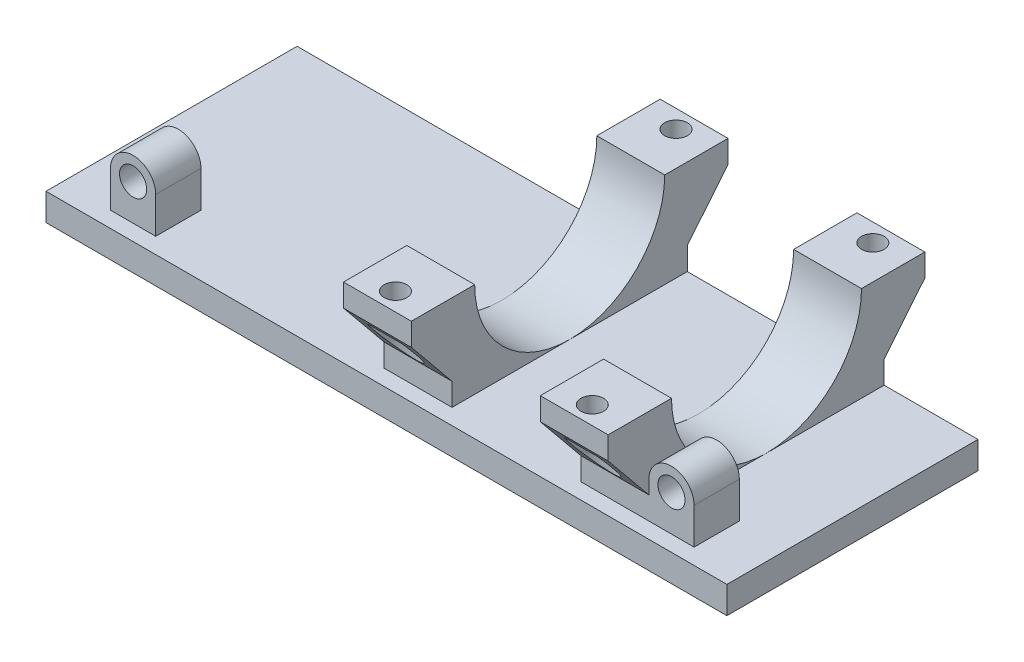
from build123d import *

# Parameters (mm, degrees)
CROQUIS1_W                                  = 149
CROQUIS1_H                                  = 53
SALIENTE_EXTRUIR1_DEPTH                     = 6
SALIENTE_EXTRUIR2_DEPTH                     = 15
SALIENTE_EXTRUIR5_DEPTH                     = 15
CROQUIS3_R                                  = 21
CORTAR_EXTRUIR2_DEPTH                       = 140.238105417
CROQUIS6_R                                  = 3
SALIENTE_EXTRUIR11_DEPTH                    = 10
CROQUIS10_W                                 = 149
CROQUIS10_H                                 = 6
SALIENTE_EXTRUIR23_DEPTH                    = 3
CROQUIS11_W                                 = 2.25
CROQUIS11_H                                 = 56
CORTAR_EXTRUIR3_DEPTH                       = 93.895102131
CROQUIS12_W                                 = 56
CROQUIS12_H                                 = 6
SALIENTE_EXTRUIR24_DEPTH                    = 3.75
CROQUIS13_W                                 = 150.5
CROQUIS13_H                                 = 0.5
CORTAR_EXTRUIR4_DEPTH                       = 96.928684448
CROQUIS14_W                                 = 169.427236994
CROQUIS14_H                                 = 76.033419256
CORTAR_EXTRUIR5_DEPTH                       = 88.876689173
SALIENTE_EXTRUIR25_DEPTH                    = 15
CROQUIS16_R                                 = 2.5
CORTAR_EXTRUIR6_DEPTH                       = 10
CROQUIS17_R                                 = 4.5
CORTAR_EXTRUIR7_DEPTH                       = 10
SIMETR_A14_AT_THE_SECOND_PLANE_COPY_1_DEPTH = 15
SIMETR_A14_AT_THE_SECOND_PLANE_COPY_2_SK_R  = 2.5
SIMETR_A14_AT_THE_SECOND_PLANE_COPY_2_DEPTH = 10
SIMETR_A14_AT_THE_SECOND_PLANE_COPY_3_SK_R  = 4.5
SIMETR_A14_AT_THE_SECOND_PLANE_COPY_3_DEPTH = 10


with BuildPart() as part:
    # Croquis1 → Saliente-Extruir1 (new body)
    with BuildSketch(Plane(origin=(0, 0, 0), x_dir=(1, 0, 0), z_dir=(0, 1, 0))):
        Rectangle(CROQUIS1_W, CROQUIS1_H)
    extrude(amount=SALIENTE_EXTRUIR1_DEPTH)

    # Croquis2 → Saliente-Extruir2 (add)
    with BuildSketch(Plane(origin=(51.5, 0, 0), x_dir=(0, 0, -1), z_dir=(1, 0, 0))):
        with BuildLine():
            Line((26, 6), (-26, 6))
            Line((-26, 6), (-26, 27))
            ThreePointArc((-26, 27), (0, 53), (26, 27))
            Line((26, 27), (26, 6))
        make_face()
    extrude(amount=-SALIENTE_EXTRUIR2_DEPTH)

    # Croquis5 → Saliente-Extruir5 (add)
    with BuildSketch(Plane.ZY.offset(-8)):
        with BuildLine():
            Line((-26, 6), (26, 6))
            Line((26, 6), (26, 27))
            ThreePointArc((26, 27), (0, 53), (-26, 27))
            Line((-26, 27), (-26, 6))
        make_face()
    extrude(amount=SALIENTE_EXTRUIR5_DEPTH)

    # Croquis3 → Cortar-Extruir2 (cut, through all)
    with BuildSketch(Plane(origin=(51.5, 0, 0), x_dir=(0, 0, -1), z_dir=(1, 0, 0))):
        with Locations(Location((0, 27, 0), (0, 0, 270))):
            Circle(CROQUIS3_R)
    extrude(amount=-CORTAR_EXTRUIR2_DEPTH, mode=Mode.SUBTRACT)

    # Croquis10 → Saliente-Extruir23 (add)
    with BuildSketch(Plane.XY.offset(26.5)):
        with Locations((0, 3)):
            Rectangle(CROQUIS10_W, CROQUIS10_H)
    extrude(amount=SALIENTE_EXTRUIR23_DEPTH)

    # Croquis11 → Cortar-Extruir3 (cut, through all)
    with BuildSketch(Plane(origin=(0, 6, 0), x_dir=(1, 0, 0), z_dir=(0, 1, 0))):
        with Locations((73.375, -1.5)):
            Rectangle(CROQUIS11_W, CROQUIS11_H)
    extrude(amount=-CORTAR_EXTRUIR3_DEPTH, mode=Mode.SUBTRACT)

    # Croquis12 → Saliente-Extruir24 (add)
    with BuildSketch(Plane.ZY.offset(74.5)):
        with Locations((1.5, 3)):
            Rectangle(CROQUIS12_W, CROQUIS12_H)
    extrude(amount=SALIENTE_EXTRUIR24_DEPTH)

    # Croquis13 → Cortar-Extruir4 (cut, through all)
    with BuildSketch(Plane(origin=(0, 6, 0), x_dir=(1, 0, 0), z_dir=(0, 1, 0))):
        with Locations((-3, 26.25)):
            Rectangle(CROQUIS13_W, CROQUIS13_H)
    extrude(amount=-CORTAR_EXTRUIR4_DEPTH, mode=Mode.SUBTRACT)

    # Croquis14 → Cortar-Extruir5 (cut, through all)
    with BuildSketch(Plane(origin=(0, 27, 0), x_dir=(-1, 0, 0), z_dir=(0, -1, 0))):
        Rectangle(CROQUIS14_W, CROQUIS14_H)
    extrude(amount=-CORTAR_EXTRUIR5_DEPTH, mode=Mode.SUBTRACT)



with BuildPart() as body_2:
    # Croquis6 → Saliente-Extruir11 (new body)
    with BuildSketch(Plane.XY.offset(26)):
        with BuildLine():
            Line((61.5, 6), (51.5, 6))
            Line((51.5, 6), (51.5, 14))
            ThreePointArc((51.5, 14), (56.5, 19), (61.5, 14))
            Line((61.5, 14), (61.5, 6))
        make_face()
        with Locations((56.5, 14)):
            Circle(CROQUIS6_R, mode=Mode.SUBTRACT)
    extrude(amount=-SALIENTE_EXTRUIR11_DEPTH)


with BuildPart() as body_3:
    # Simetría11: mirrored copy
    add(body_2.part.mirror(Plane(origin=(-3, 0, 0), x_dir=(0, 0, 1), z_dir=(1, 0, 0))))


with BuildPart() as part_1:
    add(part.part)

    add(body_2.part)  # Saliente-Extruir25 merges body 2
    # Croquis15 → Saliente-Extruir25 (add)
    with BuildSketch(Plane(origin=(51.5, 0, 0), x_dir=(0, 0, -1), z_dir=(1, 0, 0))):
        Polygon((-26, 27), (-35, 27), (-35, 22), (-26, 11), align=None)
    saliente_extruir25 = extrude(amount=-SALIENTE_EXTRUIR25_DEPTH)

    # Croquis16 → Cortar-Extruir6 (cut)
    with BuildSketch(Plane(origin=(0, 27, 0), x_dir=(1, 0, 0), z_dir=(0, 1, 0))):
        with Locations(Location((44, -31, 0), (0, 0, 270))):
            Circle(CROQUIS16_R)
    cortar_extruir6 = extrude(amount=-CORTAR_EXTRUIR6_DEPTH, mode=Mode.SUBTRACT)

    # Croquis17 → Cortar-Extruir7 (cut)
    with BuildSketch(Plane(origin=(0, 20.17, 0), x_dir=(1, 0, 0), z_dir=(0, 1, 0))):
        with Locations((44, -31)):
            Circle(CROQUIS17_R)
    cortar_extruir7 = extrude(amount=-CORTAR_EXTRUIR7_DEPTH, mode=Mode.SUBTRACT)

    # Simetría14: Saliente-Extruir25, Cortar-Extruir6, Cortar-Extruir7 across plane
    add(saliente_extruir25.mirror(Plane.XY))
    add(cortar_extruir6.mirror(Plane.XY), mode=Mode.SUBTRACT)
    add(cortar_extruir7.mirror(Plane.XY), mode=Mode.SUBTRACT)

    # Simetría14 at the second plane: Saliente-Extruir25, Cortar-Extruir6, Cortar-Extruir7 across plane
    add(saliente_extruir25.mirror(Plane.ZY.offset(-22.25)))
    add(cortar_extruir6.mirror(Plane.ZY.offset(-22.25)), mode=Mode.SUBTRACT)
    add(cortar_extruir7.mirror(Plane.ZY.offset(-22.25)), mode=Mode.SUBTRACT)

    # Simetría14 at the second plane copy 1 sk → Simetría14 at the second plane copy 1 (add)
    with BuildSketch(Plane.ZY.offset(7)):
        Polygon((-26, 27), (-35, 27), (-35, 22), (-26, 11), align=None)
    extrude(amount=-SIMETR_A14_AT_THE_SECOND_PLANE_COPY_1_DEPTH)

    # Simetría14 at the second plane copy 2 sk → Simetría14 at the second plane copy 2 (cut)
    with BuildSketch(Plane(origin=(44.5, 27, 0), x_dir=(-1, 0, 0), z_dir=(0, 1, 0))):
        with Locations(Location((44, -31, 0), (0, 0, 270))):
            Circle(SIMETR_A14_AT_THE_SECOND_PLANE_COPY_2_SK_R)
    extrude(amount=-SIMETR_A14_AT_THE_SECOND_PLANE_COPY_2_DEPTH, mode=Mode.SUBTRACT)

    # Simetría14 at the second plane copy 3 sk → Simetría14 at the second plane copy 3 (cut)
    with BuildSketch(Plane(origin=(44.5, 20.17, 0), x_dir=(-1, 0, 0), z_dir=(0, 1, 0))):
        with Locations((44, -31)):
            Circle(SIMETR_A14_AT_THE_SECOND_PLANE_COPY_3_SK_R)
    extrude(amount=-SIMETR_A14_AT_THE_SECOND_PLANE_COPY_3_DEPTH, mode=Mode.SUBTRACT)


solid = Compound([body_3.part, part_1.part])
